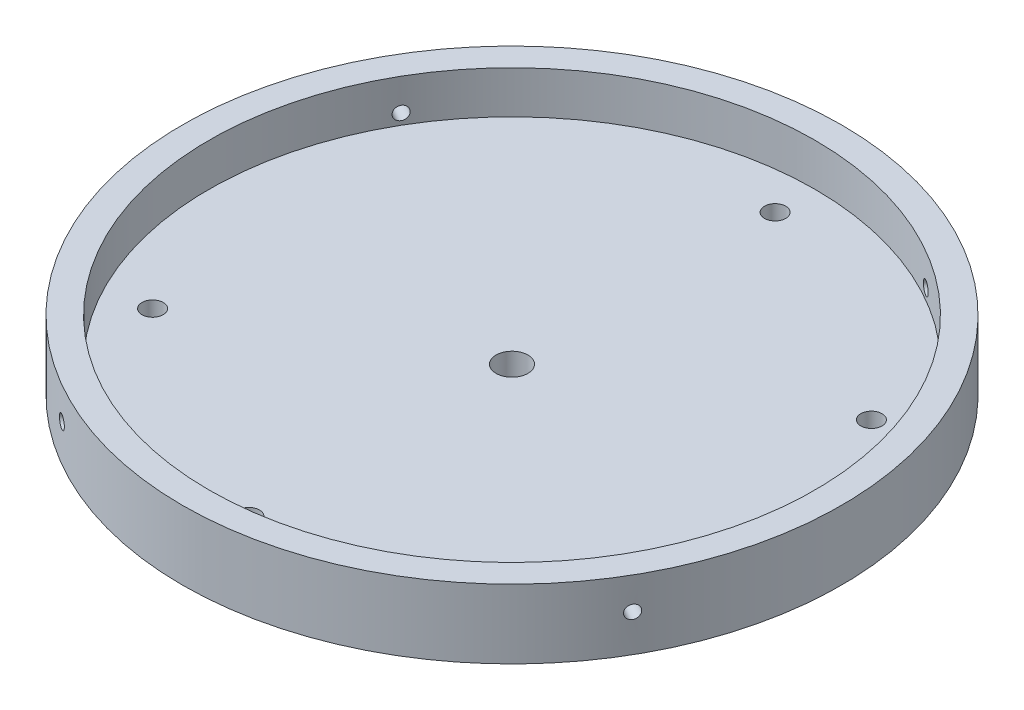
from build123d import *

# Parameters (mm, degrees)
SKETCH1_R               = 62
BOSS_EXTRUDE1_DEPTH     = 5
SKETCH2_R               = 2
CUT_EXTRUDE1_DEPTH      = 5
CIRPATTERN1_COUNT       = 2
CIRPATTERN1_ANGLE       = 120
MIRROR1_COPY_1_SKETCH_R = 2
MIRROR1_COPY_1_DEPTH    = 5
SKETCH5_R               = 62
SKETCH5_R_2             = 57
BOSS_EXTRUDE2_DEPTH     = 8
CUT_EXTRUDE2_START      = -90
SKETCH6_R               = 1.25
CUT_EXTRUDE2_DEPTH      = 192
CIRPATTERN2_COUNT       = 2
CIRPATTERN2_ANGLE       = 90
SKETCH7_R               = 3
CUT_EXTRUDE3_DEPTH      = 10


with BuildPart() as part:
    # Sketch1 → Boss-Extrude1 (new body)
    with BuildSketch(Plane(origin=(0, 0, 0), x_dir=(1, 0, 0), z_dir=(0, 1, 0))):
        with Locations(Location((0, 0, 0), (0, 0, 270))):
            Circle(SKETCH1_R)
    extrude(amount=BOSS_EXTRUDE1_DEPTH)

    # Sketch2 → Cut-Extrude1 (cut)
    with BuildSketch(Plane(origin=(0, 5, 0), x_dir=(1, 0, 0), z_dir=(0, 1, 0))):
        with Locations(Location((0, 49.5, 0), (0, 0, 270))):
            Circle(SKETCH2_R)
    cut_extrude1 = extrude(amount=-CUT_EXTRUDE1_DEPTH, mode=Mode.SUBTRACT)

    # CirPattern1: Cut-Extrude1 ×2 about axis
    cirpattern1_axis = Axis((0, 5, 0), (0, 1, 0))
    for i in range(1, CIRPATTERN1_COUNT):
        add(cut_extrude1.rotate(cirpattern1_axis, i * CIRPATTERN1_ANGLE / (CIRPATTERN1_COUNT - 1)), mode=Mode.SUBTRACT)

    # Mirror1: Cut-Extrude1 across plane
    add(cut_extrude1.mirror(Plane(origin=(0, 0, 0), x_dir=(-0.49999999999999806, 0, 0.8660254037844398), z_dir=(-0.8660254037844398, 0, -0.49999999999999806))), mode=Mode.SUBTRACT)

    # Mirror1 copy 1 sketch → Mirror1 copy 1 (cut)
    with BuildSketch(Plane(origin=(0, 5, 0), x_dir=(1, 0, 0), z_dir=(0, 1, 0))):
        with Locations((0, -49.5)):
            Circle(MIRROR1_COPY_1_SKETCH_R)
    extrude(amount=-MIRROR1_COPY_1_DEPTH, mode=Mode.SUBTRACT)

    # Sketch5 → Boss-Extrude2 (add)
    with BuildSketch(Plane(origin=(0, 5, 0), x_dir=(1, 0, 0), z_dir=(0, 1, 0))):
        with Locations(Location((0, 0, 0), (0, 0, 270))):
            Circle(SKETCH5_R)
        with Locations(Location((0, 0, 0), (0, 0, 270))):
            Circle(SKETCH5_R_2, mode=Mode.SUBTRACT)
    extrude(amount=BOSS_EXTRUDE2_DEPTH)

    # Sketch6 → Cut-Extrude2 (cut)
    with BuildSketch(Plane(origin=(0, 0, 0), x_dir=(-0.49999999999999806, 0, 0.8660254037844398), z_dir=(-0.8660254037844398, 0, -0.49999999999999806)).offset(CUT_EXTRUDE2_START)):
        with Locations(Location((0, 7, 0), (0, 0, 180))):
            Circle(SKETCH6_R)
    cut_extrude2 = extrude(amount=CUT_EXTRUDE2_DEPTH, mode=Mode.SUBTRACT)

    # CirPattern2: Cut-Extrude2 ×2 about axis
    cirpattern2_axis = Axis((0, 13, 0), (0, 1, 0))
    for i in range(1, CIRPATTERN2_COUNT):
        add(cut_extrude2.rotate(cirpattern2_axis, i * CIRPATTERN2_ANGLE / (CIRPATTERN2_COUNT - 1)), mode=Mode.SUBTRACT)

    # Sketch7 → Cut-Extrude3 (cut)
    with BuildSketch(Plane(origin=(0, 5, 0), x_dir=(1, 0, 0), z_dir=(0, 1, 0))):
        with Locations(Location((0, 0, 0), (0, 0, 270))):
            Circle(SKETCH7_R)
    extrude(amount=-CUT_EXTRUDE3_DEPTH, mode=Mode.SUBTRACT)


solid = part.part
